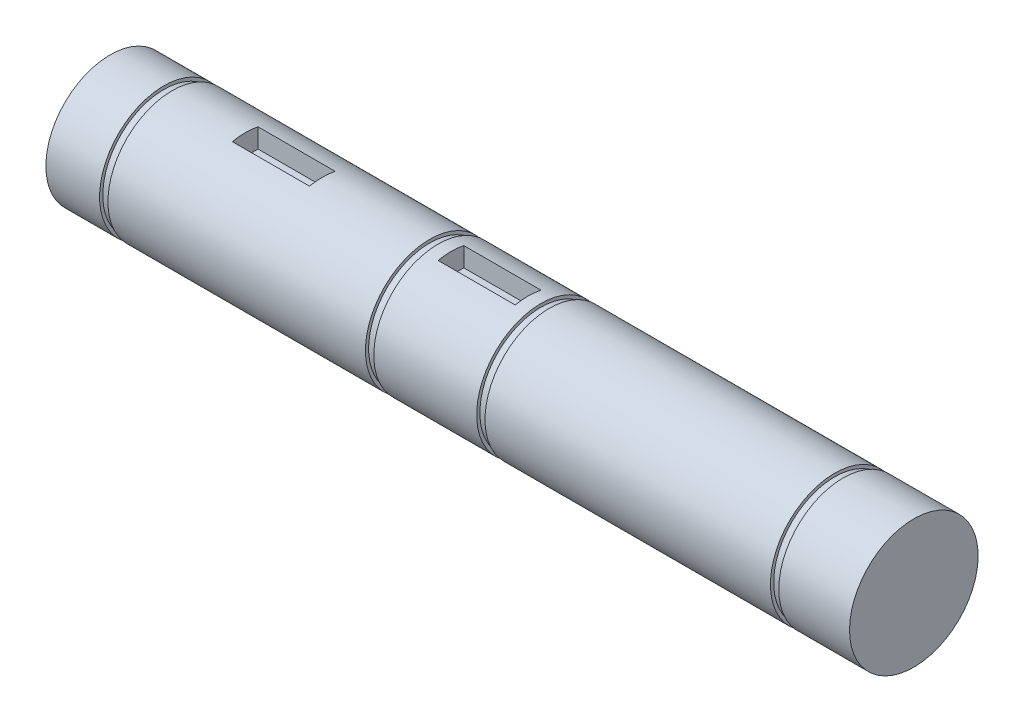
from build123d import *

# Parameters (mm, degrees)
SKETCH1_R           = 10
BOSS_EXTRUDE1_DEPTH = 77.5
SKETCH2_W           = 12
SKETCH2_H           = 4
CUT_EXTRUDE1_DEPTH  = 3.2
SKETCH5_W           = 1.3
SKETCH5_H           = 0.5
SKETCH6_W           = 30
SKETCH6_H           = 20
CUT_EXTRUDE2_DEPTH  = 81.661329025


with BuildPart() as part:
    # Sketch1 → Boss-Extrude1 (new, symmetric)
    with BuildSketch(Plane(origin=(0, 0, 0), x_dir=(0, 0, -1), z_dir=(1, 0, 0))):
        Circle(SKETCH1_R)
    extrude(amount=BOSS_EXTRUDE1_DEPTH, both=True)

    # Sketch2 → Cut-Extrude1 (cut)
    with BuildSketch(Plane(origin=(0, 10, 0), x_dir=(1, 0, 0), z_dir=(0, 1, 0))):
        with Locations((-50.5, 0)):
            Rectangle(SKETCH2_W, SKETCH2_H)
        with Locations((-18.5, 0)):
            Rectangle(SKETCH2_W, SKETCH2_H)
        with Locations((66.5, 0)):
            Rectangle(SKETCH2_W, SKETCH2_H)
    extrude(amount=-CUT_EXTRUDE1_DEPTH, mode=Mode.SUBTRACT)

    # Sketch5 → Cut-Revolve2 (revolve, cut)
    with BuildSketch(Plane.XY, mode=Mode.PRIVATE) as cut_revolve2_sk:
        with Locations((-27.15, 9.75)):
            Rectangle(SKETCH5_W, SKETCH5_H)
        with Locations((-9.85, 9.75)):
            Rectangle(SKETCH5_W, SKETCH5_H)
        with Locations((75.15, 9.75)):
            Rectangle(SKETCH5_W, SKETCH5_H)
        with Locations((57.85, 9.75)):
            Rectangle(SKETCH5_W, SKETCH5_H)
        with Locations((35.85, 9.75)):
            Rectangle(SKETCH5_W, SKETCH5_H)
        with Locations((-68.5, 9.75)):
            Rectangle(SKETCH5_W, SKETCH5_H)
    revolve(cut_revolve2_sk.sketch.rotate(Axis((0, 0, 0), (-1, 0, 0)), 90), axis=Axis((0, 0, 0), (-1, 0, 0)), mode=Mode.SUBTRACT)

    # Sketch6 → Cut-Extrude2 (cut, through all)
    with BuildSketch(Plane(origin=(0, 10, 0), x_dir=(1, 0, 0), z_dir=(0, 1, 0))):
        with Locations((62.5, 0)):
            Rectangle(SKETCH6_W, SKETCH6_H)
    extrude(amount=-CUT_EXTRUDE2_DEPTH, mode=Mode.SUBTRACT)


solid = part.part
